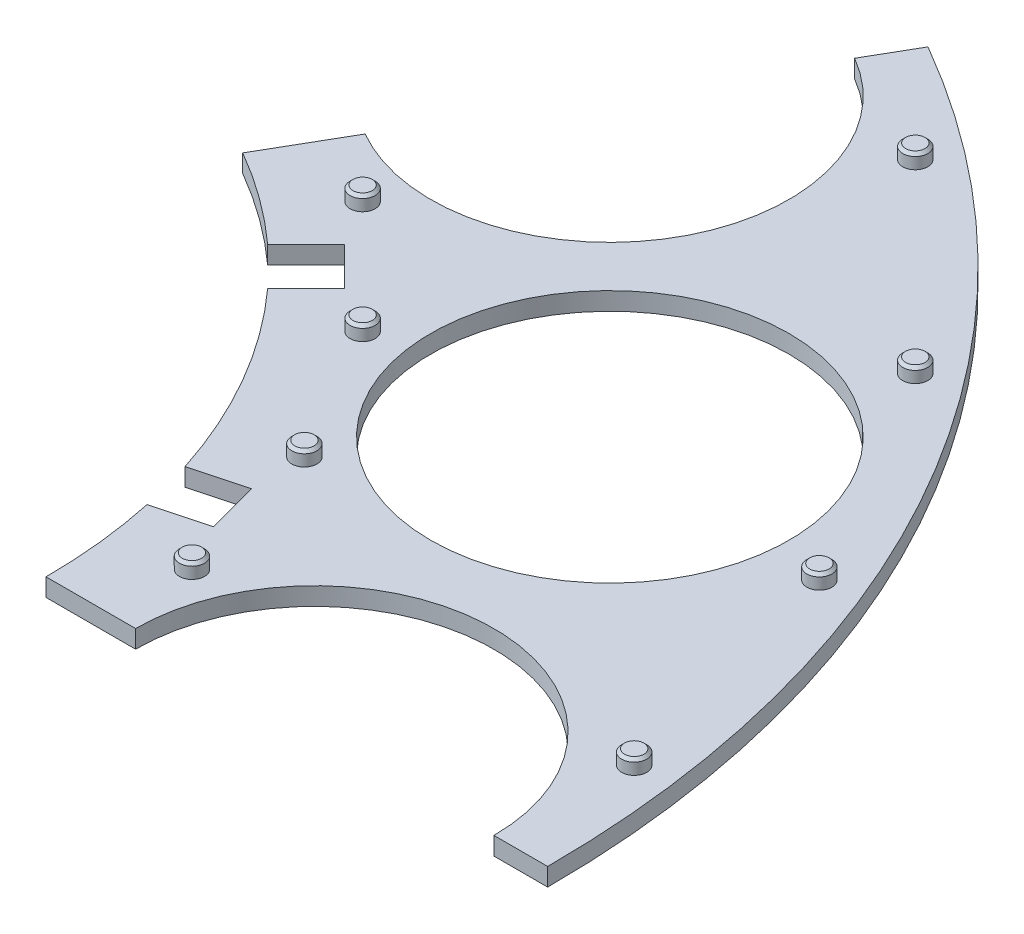
from build123d import *

# Parameters (mm, degrees)
AUFSATZ_LINEAR_AUSTRAGEN1_DEPTH = 5
SKIZZE2_R                       = 50
SCHNITT_LINEAR_AUSTRAGEN1_DEPTH = 384.666521865
SKIZZE3_R                       = 3.5
AUFSATZ_LINEAR_AUSTRAGEN2_DEPTH = 4
FASE1_SIZE                      = 0.8
SCHNITT_LINEAR_AUSTRAGEN2_DEPTH = 384.666521865


with BuildPart() as part:
    # Skizze1 → Aufsatz-Linear austragen1 (new body)
    with BuildSketch(Plane(origin=(0, 0, 0), x_dir=(1, 0, 0), z_dir=(0, 1, 0))):
        with BuildLine():
            Line((150, 0), (290, 0))
            ThreePointArc((290, 0), (251.147367097, 145), (145, 251.147367097))
            Line((145, 251.147367097), (75, 129.903810568))
            ThreePointArc((75, 129.903810568), (129.903810568, 75), (150, 0))
        make_face()
    extrude(amount=AUFSATZ_LINEAR_AUSTRAGEN1_DEPTH)

    # Skizze2 → Schnitt-Linear austragen1 (cut, through all)
    with BuildSketch(Plane(origin=(0, 5, 0), x_dir=(1, 0, 0), z_dir=(0, 1, 0))):
        with Locations((112.5, 194.855715851)):
            Circle(SKIZZE2_R)
        with Locations(Location((194.855715851, 112.5, 0), (0, 0, 270))):
            Circle(SKIZZE2_R)
        with Locations((225, 0)):
            Circle(SKIZZE2_R)
    extrude(amount=-SCHNITT_LINEAR_AUSTRAGEN1_DEPTH, mode=Mode.SUBTRACT)

    # Skizze3 → Aufsatz-Linear austragen2 (add)
    with BuildSketch(Plane(origin=(0, 5, 0), x_dir=(1, 0, 0), z_dir=(0, 1, 0))):
        with Locations(Location((168.545626434, 22.189452677, 0), (0, 0, 270))):
            Circle(SKIZZE3_R)
        with Locations(Location((277.604561185, 36.547333822, 0), (0, 0, 270))):
            Circle(SKIZZE3_R)
        with Locations(Location((157.059520527, 65.056183502, 0), (0, 0, 270))):
            Circle(SKIZZE3_R)
        with Locations(Location((134.87006785, 103.489442931, 0), (0, 0, 270))):
            Circle(SKIZZE3_R)
        with Locations(Location((103.489442931, 134.87006785, 0), (0, 0, 270))):
            Circle(SKIZZE3_R)
        with Locations(Location((170.453200122, 222.138935282, 0), (0, 0, 270))):
            Circle(SKIZZE3_R)
        with Locations(Location((222.138935282, 170.453200122, 0), (0, 0, 270))):
            Circle(SKIZZE3_R)
        with Locations(Location((258.686269103, 107.151361062, 0), (0, 0, 270))):
            Circle(SKIZZE3_R)
    extrude(amount=AUFSATZ_LINEAR_AUSTRAGEN2_DEPTH)

    # Fase1
    fase1_edges = [part.edges().sort_by_distance(p)[0] for p in [
        (168.545626434, 9, -25.689452677),
        (277.604561185, 9, -40.047333822),
        (157.059520527, 9, -68.556183502),
        (134.87006785, 9, -106.989442931),
        (103.489442931, 9, -138.37006785),
        (170.453200122, 9, -225.638935282),
        (222.138935282, 9, -173.953200122),
        (258.686269103, 9, -110.651361062),
    ]]
    chamfer(fase1_edges, length=FASE1_SIZE)

    # Skizze4 → Schnitt-Linear austragen2 (cut, through all)
    with BuildSketch(Plane(origin=(0, 5, 0), x_dir=(1, 0, 0), z_dir=(0, 1, 0))):
        with BuildLine():
            Line((100.63005083, 111.236652548), (111.369318037, 121.975919755))
            Line((111.369318037, 121.975919755), (121.975919755, 111.369318037))
            Line((121.975919755, 111.369318037), (111.236652548, 100.63005083))
            ThreePointArc((111.236652548, 100.63005083), (106.066017178, 106.066017178), (100.63005083, 111.236652548))
        make_face()
        with BuildLine():
            Line((142.766506677, 46.018741523), (157.436618499, 49.949586139))
            Line((157.436618499, 49.949586139), (161.318904176, 35.460698745))
            Line((161.318904176, 35.460698745), (146.648792353, 31.529854129))
            ThreePointArc((146.648792353, 31.529854129), (144.888873943, 38.822856765), (142.766506677, 46.018741523))
        make_face()
    extrude(amount=-SCHNITT_LINEAR_AUSTRAGEN2_DEPTH, mode=Mode.SUBTRACT)


solid = part.part
